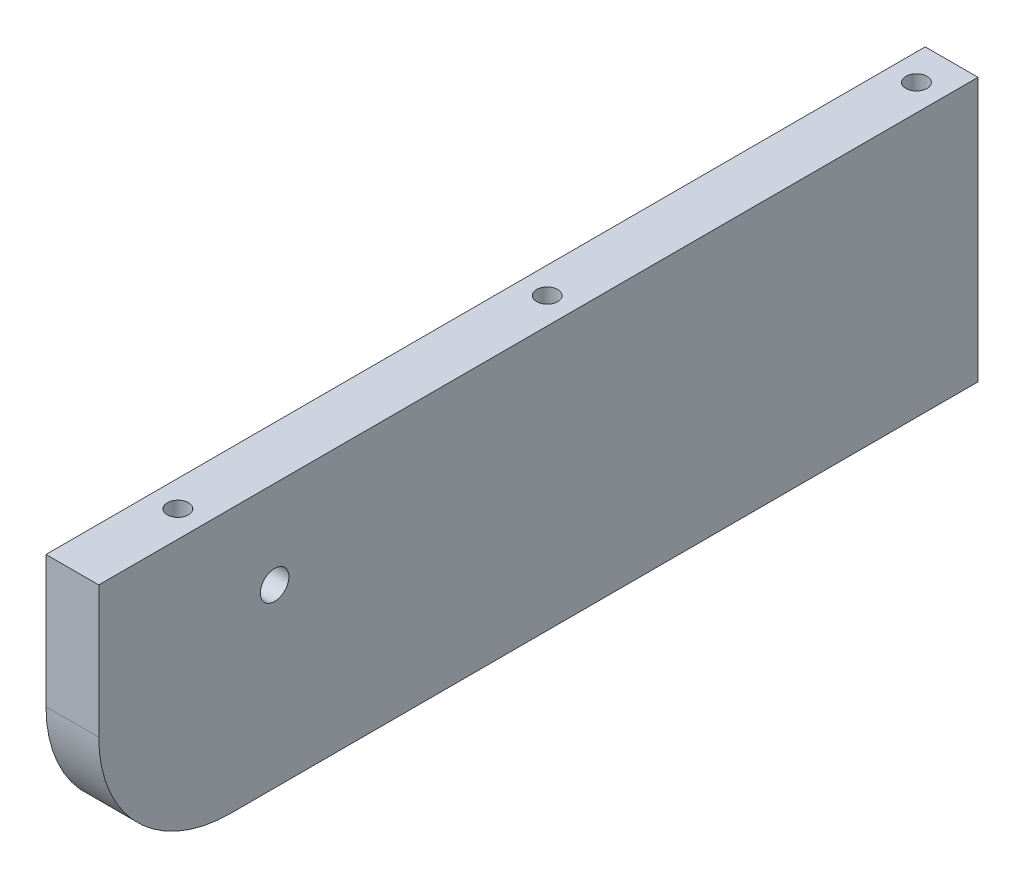
from build123d import *

# Parameters (mm, degrees)
SKETCH1_W                      = 100
SKETCH1_H                      = 30
SKETCH1_R                      = 1.625
BOSS_EXTRUDE1_DEPTH            = 6
FILLET1_R                      = 15
CBORE_FOR_M2_SHCS1_D           = 2.4
CBORE_FOR_M2_SHCS1_DEPTH       = 20
CBORE_FOR_M2_SHCS1_CBORE_D     = 4.4
CBORE_FOR_M2_SHCS1_CBORE_DEPTH = 2
CBORE_FOR_M2_SHCS1_TIP         = 0.721032743


with BuildPart() as part:
    # Sketch1 → Boss-Extrude1 (new body)
    with BuildSketch(Plane(origin=(0, 0, 0), x_dir=(0, 0, -1), z_dir=(1, 0, 0))):
        Rectangle(SKETCH1_W, SKETCH1_H)
        with Locations((-30, 5)):
            Circle(SKETCH1_R, mode=Mode.SUBTRACT)
    extrude(amount=BOSS_EXTRUDE1_DEPTH)

    # Fillet1
    fillet1_edges = [part.edges().sort_by_distance(p)[0] for p in [
        (3, -15, 50),
    ]]
    fillet(fillet1_edges, radius=FILLET1_R)

    # CBORE for M2 SHCS1
    with Locations(Plane(origin=(-622.293536786, 25, -1323.282701689), x_dir=(1, 0, 0), z_dir=(0, 1, 0))):
        with Locations((727.293536786, -1277.282701689), (727.293536786, -1361.282701689), (625.293536786, -1277.282701689), (625.293536786, -1361.282701689), (625.293536786, -1319.282701689), (727.293536786, -1319.282701689)):
            CounterBoreHole(CBORE_FOR_M2_SHCS1_D / 2, CBORE_FOR_M2_SHCS1_CBORE_D / 2, CBORE_FOR_M2_SHCS1_CBORE_DEPTH, depth=CBORE_FOR_M2_SHCS1_DEPTH)
            with Locations((0, 0, -(CBORE_FOR_M2_SHCS1_DEPTH + CBORE_FOR_M2_SHCS1_TIP / 2))):  # 118° drill point
                Cone(0, CBORE_FOR_M2_SHCS1_D / 2, CBORE_FOR_M2_SHCS1_TIP, mode=Mode.SUBTRACT)


solid = part.part
